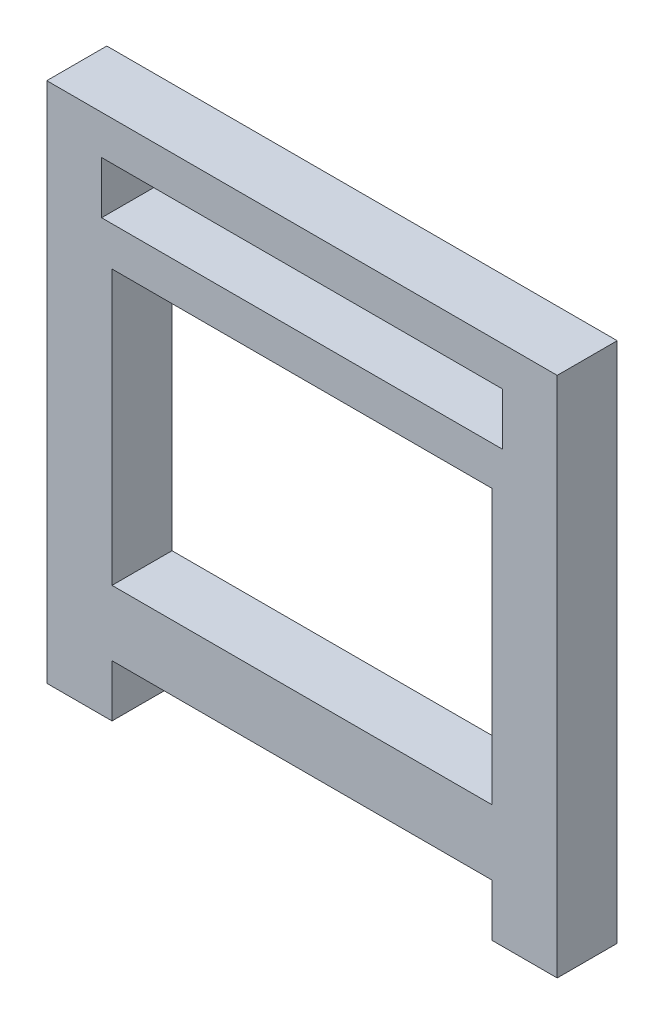
from build123d import *

# Parameters (mm, degrees)
SKETCH1_W           = 14.56
SKETCH1_H           = 10.5
SKETCH1_W_2         = 15.36
SKETCH1_H_2         = 2
BOSS_EXTRUDE1_DEPTH = 2.3


with BuildPart() as part:
    # Sketch1 → Boss-Extrude1 (new body)
    with BuildSketch(Plane.XY):
        Polygon((0, 0), (0, -2), (2.5, -2), (2.5, 0), (17.06, 0), (17.06, -2), (19.56, -2), (19.56, 0), (19.56, 18), (0, 18), align=None)
        with Locations((9.78, 7.75)):
            Rectangle(SKETCH1_W, SKETCH1_H, mode=Mode.SUBTRACT)
        with Locations((9.78, 15.5)):
            Rectangle(SKETCH1_W_2, SKETCH1_H_2, mode=Mode.SUBTRACT)
    extrude(amount=BOSS_EXTRUDE1_DEPTH)


solid = part.part
